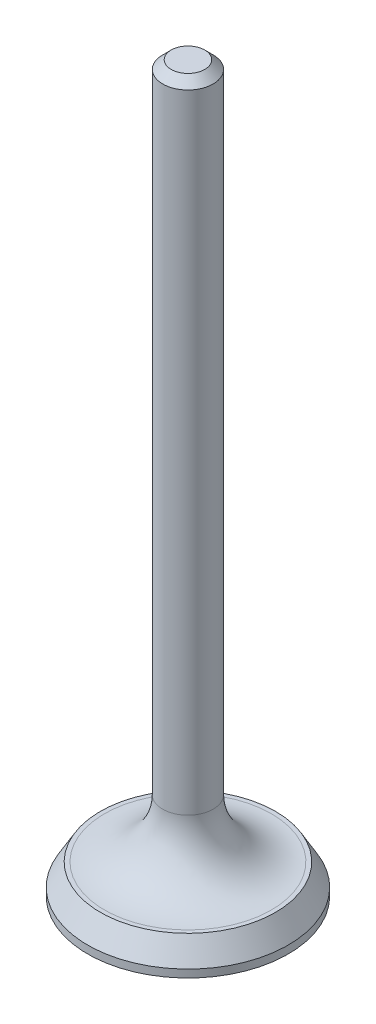
from build123d import *


with BuildPart() as part:
    # Эскиз1 → Повернуть1 (revolve)
    with BuildSketch(Plane.XY, mode=Mode.PRIVATE) as revolve_1_sk:
        with BuildLine():
            Line((0, 0), (0, 112))
            Line((0, 112), (2.6, 112))
            Line((2.6, 112), (3.9, 110.7))
            Line((3.9, 110.7), (3.9, 13.6))
            ThreePointArc((3.9, 13.6), (6.536038969, 7.236038969), (12.9, 4.6))
            Line((12.9, 4.6), (13.537009085, 4.6))
            Line((13.537009085, 4.6), (15.5, 1.2))
            Line((15.5, 1.2), (15.5, 0))
            Line((15.5, 0), (0, 0))
        make_face()
    revolve(revolve_1_sk.sketch.rotate(Axis((0, 0, 0), (0, 1, 0)), 90), axis=Axis((0, 0, 0), (0, 1, 0)))


solid = part.part
